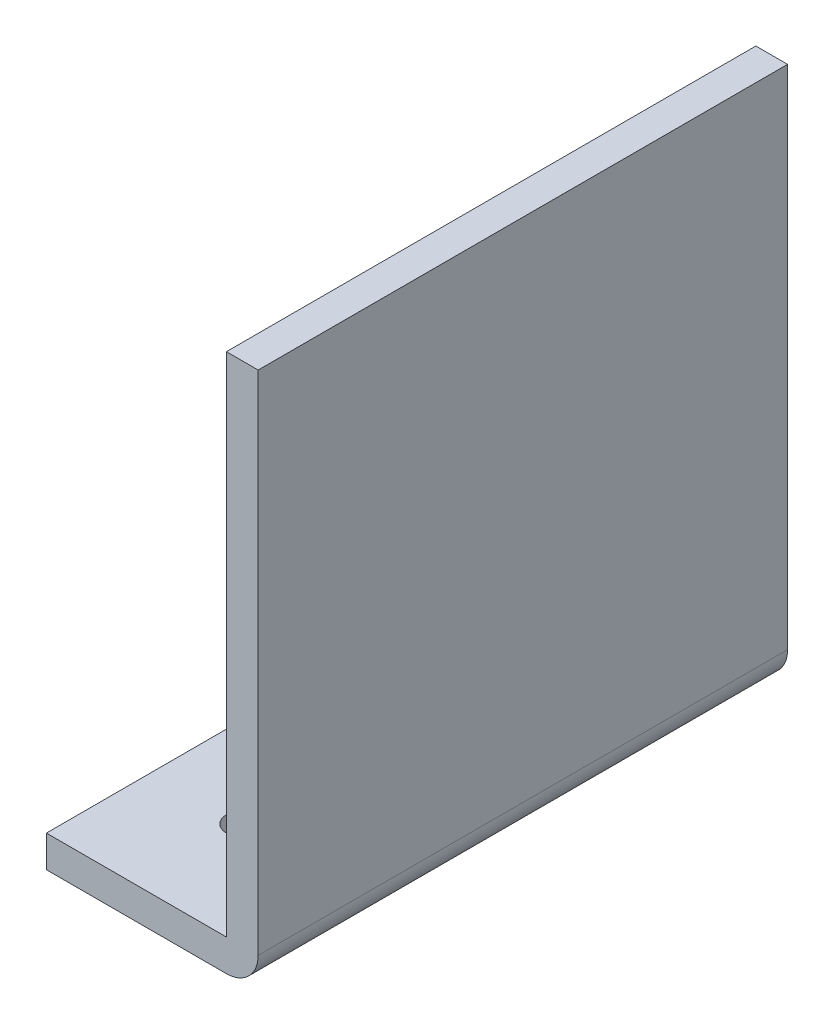
from build123d import *

# Parameters (mm, degrees)
BOSS_EXTRU_1_DEPTH      = 25
ESQUISSE2_R             = 1.5
ENL_V_MAT_EXTRU_1_DEPTH = 50


with BuildPart() as part:
    # Esquisse1 → Boss.-Extru.1 (new, symmetric)
    with BuildSketch(Plane.XY):
        with BuildLine():
            Line((-20, 0), (-3, 0))
            ThreePointArc((-3, 0), (-0.878679656, 0.878679656), (0, 3))
            Line((0, 3), (0, 50.87))
            Line((0, 50.87), (-3, 50.87))
            Line((-3, 50.87), (-3, 3))
            Line((-3, 3), (-20, 3))
            Line((-20, 3), (-20, 0))
        make_face()
    extrude(amount=BOSS_EXTRU_1_DEPTH, both=True)

    # Esquisse2 → Enlèv. mat.-Extru.1 (cut)
    with BuildSketch(Plane(origin=(0, 3, 0), x_dir=(1, 0, 0), z_dir=(0, 1, 0))):
        with Locations(Location((-11.5, 15, 0), (0, 0, 270))):
            Circle(ESQUISSE2_R)
        with Locations(Location((-11.5, -15, 0), (0, 0, 270))):
            Circle(ESQUISSE2_R)
    extrude(amount=-ENL_V_MAT_EXTRU_1_DEPTH, mode=Mode.SUBTRACT)


solid = part.part
